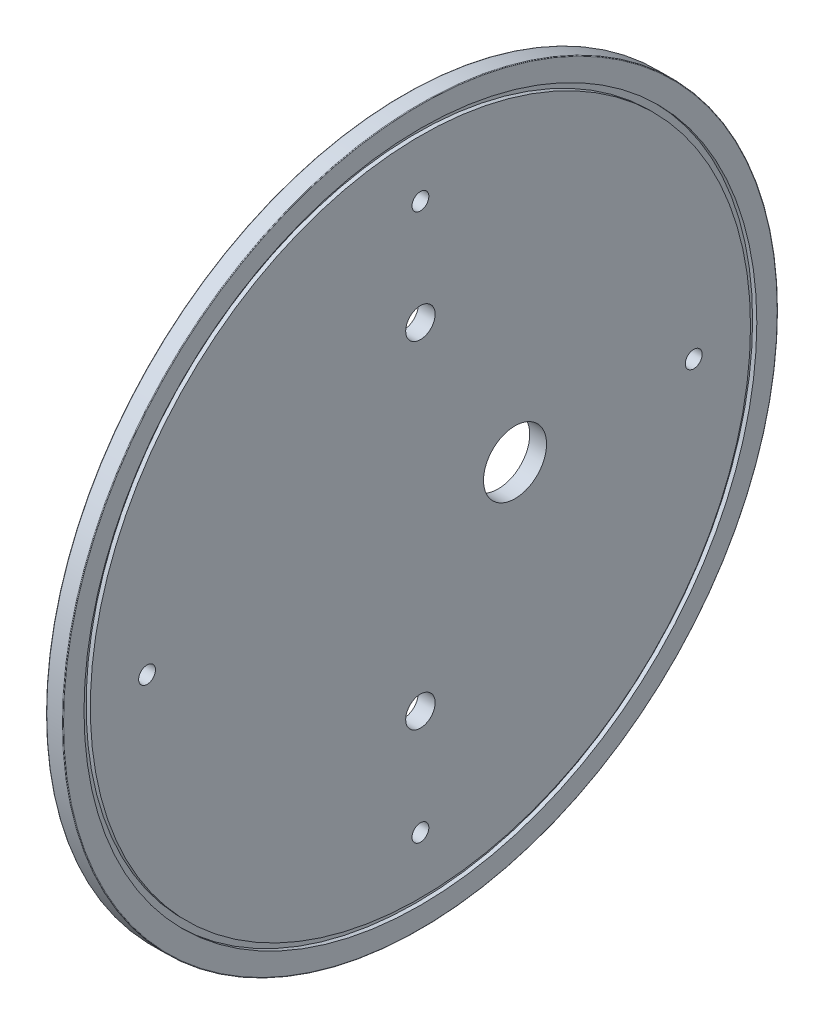
from build123d import *

# Parameters (mm, degrees)
SKETCH_1_R               = 170
EXTRUDE_1_DEPTH          = 8
SKETCH_5_R               = 4
CUT_EXTRUDE_4_DEPTH      = 10
PATTERN_CIRCULAR_3_COUNT = 4
SKETCH_7_R               = 160
SKETCH_7_R_2             = 157
CUT_EXTRUDE_5_DEPTH      = 2
FILLET_1_R               = 0.3
SKETCH_8_R               = 15
CUT_EXTRUDE_6_DEPTH      = 10
SKETCH_10_R              = 7
CUT_EXTRUDE_7_DEPTH      = 10


with BuildPart() as part:
    # 草图1 → 凸台-拉伸1 (new body)
    with BuildSketch(Plane(origin=(0, 0, 0), x_dir=(0, 0, -1), z_dir=(1, 0, 0))):
        Circle(SKETCH_1_R)
    extrude(amount=EXTRUDE_1_DEPTH)

    # 草图5 → 切除-拉伸4 (cut)
    with BuildSketch(Plane(origin=(8, 0, 0), x_dir=(0, 0, -1), z_dir=(1, 0, 0))):
        with Locations((0, 130)):
            Circle(SKETCH_5_R)
    cut_extrude_4 = extrude(amount=-CUT_EXTRUDE_4_DEPTH, mode=Mode.SUBTRACT)

    # 阵列(圆周)3: 切除-拉伸4 ×4 about axis
    pattern_circular_3_axis = Axis((0, 0, 0), (1, 0, 0))
    for i in range(1, PATTERN_CIRCULAR_3_COUNT):
        add(cut_extrude_4.rotate(pattern_circular_3_axis, i * 360 / PATTERN_CIRCULAR_3_COUNT), mode=Mode.SUBTRACT)

    # 草图7 → 切除-拉伸5 (cut)
    with BuildSketch(Plane(origin=(8, 0, 0), x_dir=(0, 0, -1), z_dir=(1, 0, 0))):
        Circle(SKETCH_7_R)
        Circle(SKETCH_7_R_2, mode=Mode.SUBTRACT)
    extrude(amount=-CUT_EXTRUDE_5_DEPTH, mode=Mode.SUBTRACT)

    # 圆角1
    fillet_1_edges = [part.edges().sort_by_distance(p)[0] for p in [
        (0, 0, 170),
        (8, 0, 170),
    ]]
    fillet(fillet_1_edges, radius=FILLET_1_R)

    # 草图8 → 切除-拉伸6 (cut)
    with BuildSketch(Plane(origin=(8, 0, 0), x_dir=(0, 0, -1), z_dir=(1, 0, 0))):
        with Locations((45, 0)):
            Circle(SKETCH_8_R)
    extrude(amount=-CUT_EXTRUDE_6_DEPTH, mode=Mode.SUBTRACT)

    # 草图10 → 切除-拉伸7 (cut)
    with BuildSketch(Plane.ZY):
        with Locations((0, -80)):
            Circle(SKETCH_10_R)
        with Locations((0, 80)):
            Circle(SKETCH_10_R)
    extrude(amount=-CUT_EXTRUDE_7_DEPTH, mode=Mode.SUBTRACT)


solid = part.part
